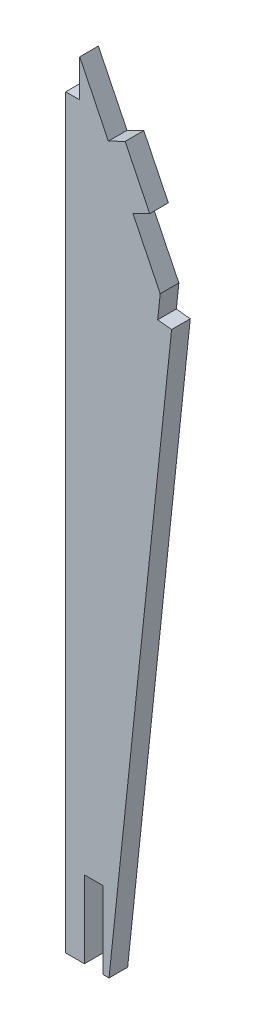
from build123d import *

# Parameters (mm, degrees)
EXTRUDE_1_DEPTH = 2


with BuildPart() as part:
    # 草图1 → 凸台-拉伸1 (new body)
    with BuildSketch(Plane.XY):
        Polygon((16.743747017, 69.090676734), (18.235454816, 68.933171679), (11.528007373, 5.407898328), (10.890762399, 5.407898328), (10.890762399, 13.657898328), (8.890762399, 13.657898328), (8.890762399, 5.407898328), (6.890762399, 5.407898328), (6.890762399, 85.315876733), (8.390762399, 85.315876733), (8.390762399, 89.315876733), (11.459360427, 83.024318409), (13.256948519, 83.901060703), (15.8871754, 78.508296425), (14.089587308, 77.631554131), (17.012734116, 71.638214999), align=None)
    extrude(amount=EXTRUDE_1_DEPTH)


solid = part.part
